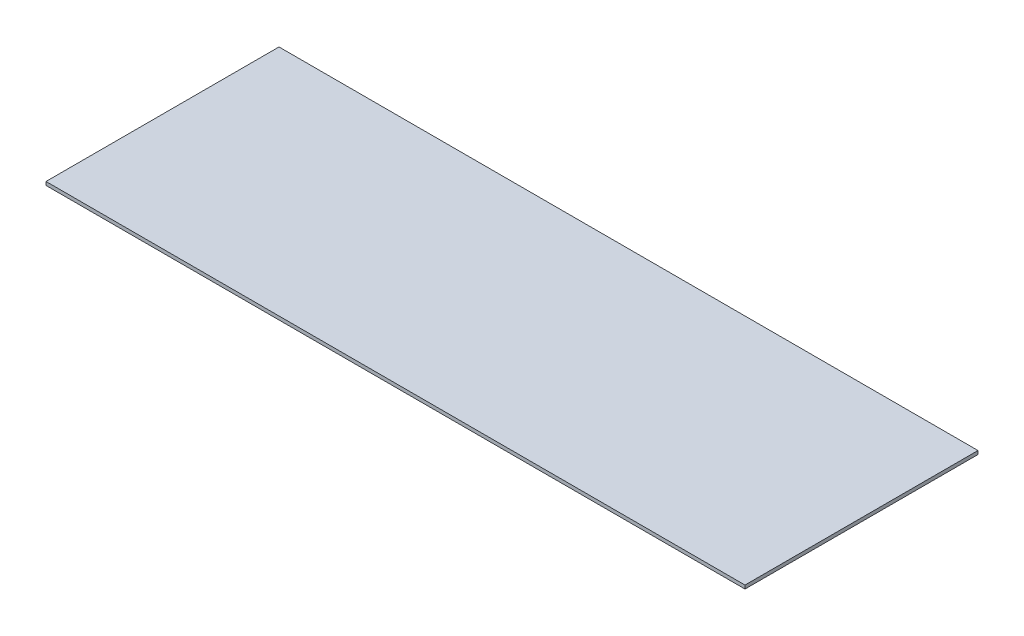
from build123d import *

# Parameters (mm, degrees)
SKETCH1_W           = 1200
SKETCH1_H           = 400
BOSS_EXTRUDE1_DEPTH = 6


with BuildPart() as part:
    # Sketch1 → Boss-Extrude1 (new body)
    with BuildSketch(Plane(origin=(0, 0, 0), x_dir=(1, 0, 0), z_dir=(0, 1, 0))):
        Rectangle(SKETCH1_W, SKETCH1_H)
    extrude(amount=BOSS_EXTRUDE1_DEPTH)


solid = part.part
